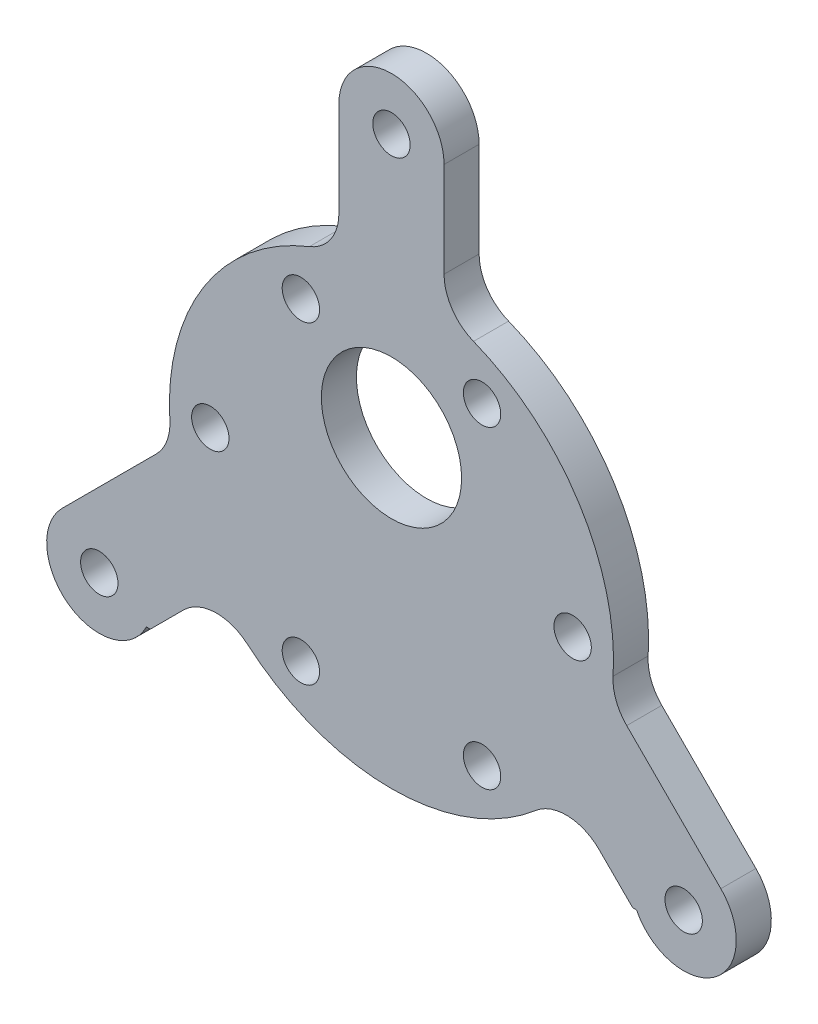
from build123d import *

# Parameters (mm, degrees)
SKETCH_1_R      = 1.6
SKETCH_1_R_2    = 6
EXTRUDE_1_DEPTH = 3
FILLET_1_R      = 4


with BuildPart() as part:
    # 草图1 → 凸台-拉伸1 (new body)
    # profile 1 of 13: a face of its own
    with BuildSketch(Plane.XY):
        with BuildLine():
            ThreePointArc((64, -7), (59.941552797, 4.736694594), (49.5, 11.459414942))
            ThreePointArc((49.5, 11.459414942), (45, 12), (40.5, 11.459414942))
            ThreePointArc((40.5, 11.459414942), (29.2006815, 3.553745068), (26.224418371, -9.911620598))
            ThreePointArc((26.224418371, -9.911620598), (27.583310363, -14.593347225), (30.0887682, -18.775192831))
            ThreePointArc((30.0887682, -18.775192831), (33.483334572, -22.111797293), (37.600675707, -24.5))
            Line((37.600675707, -24.5), (52.399324293, -24.5))
            ThreePointArc((52.399324293, -24.5), (56.516665428, -22.111797293), (59.9112318, -18.775192831))
            ThreePointArc((59.9112318, -18.775192831), (62.416689637, -14.593347225), (63.775581629, -9.911620598))
            ThreePointArc((63.775581629, -9.911620598), (63.943812327, -8.460128257), (64, -7))
        make_face()
        with Locations((37.25, -20.423393759)):
            Circle(SKETCH_1_R, mode=Mode.SUBTRACT)
        with Locations((52.75, -20.423393759)):
            Circle(SKETCH_1_R, mode=Mode.SUBTRACT)
        with Locations((29.5, -7)):
            Circle(SKETCH_1_R, mode=Mode.SUBTRACT)
        with Locations((60.5, -7)):
            Circle(SKETCH_1_R, mode=Mode.SUBTRACT)
        with Locations((45, 0)):
            Circle(SKETCH_1_R_2, mode=Mode.SUBTRACT)
        with Locations((37.25, 6.423393759)):
            Circle(SKETCH_1_R, mode=Mode.SUBTRACT)
        with Locations((52.75, 6.423393759)):
            Circle(SKETCH_1_R, mode=Mode.SUBTRACT)
    # profile 2 of 13: a face of its own
    with BuildSketch(Plane.XY):
        with BuildLine():
            ThreePointArc((30.0887682, -18.775192831), (27.583310363, -14.593347225), (26.224418371, -9.911620598))
            Line((26.224418371, -9.911620598), (16.818019485, -19.318019485))
            ThreePointArc((16.818019485, -19.318019485), (21.722075446, -18.342542104), (24.5, -22.5))
            Line((24.5, -22.5), (24.5, -24.363961031))
            Line((24.5, -24.363961031), (30.0887682, -18.775192831))
        make_face()
    # profile 3 of 13: a face of its own
    with BuildSketch(Plane.XY):
        with BuildLine():
            ThreePointArc((24.5, -22.5), (21.722075446, -18.342542104), (16.818019485, -19.318019485))
            ThreePointArc((16.818019485, -19.318019485), (15.842542104, -20.777924554), (15.5, -22.5))
            ThreePointArc((15.5, -22.5), (15.61878556, -23.527112473), (15.968871126, -24.5))
            Line((15.968871126, -24.5), (24.031128874, -24.5))
            ThreePointArc((24.031128874, -24.5), (24.38121444, -23.527112473), (24.5, -22.5))
        make_face()
        with Locations((20, -22.5)):
            Circle(SKETCH_1_R, mode=Mode.SUBTRACT)
    # profile 4 of 13: a face of its own
    with BuildSketch(Plane.XY):
        with BuildLine():
            Line((24.031128874, -24.5), (15.968871126, -24.5))
            ThreePointArc((15.968871126, -24.5), (19.272310012, -26.940773275), (23.181980515, -25.681980515))
            ThreePointArc((23.181980515, -25.681980515), (23.654655422, -25.125546372), (24.031128874, -24.5))
        make_face()
    # profile 5 of 13: a face of its own
    with BuildSketch(Plane.XY):
        with BuildLine():
            ThreePointArc((66.818019485, -25.681980515), (70.727689988, -26.940773275), (74.031128874, -24.5))
            Line((74.031128874, -24.5), (65.968871126, -24.5))
            ThreePointArc((65.968871126, -24.5), (66.345344578, -25.125546372), (66.818019485, -25.681980515))
        make_face()
    # profile 6 of 13: a face of its own
    with BuildSketch(Plane.XY):
        with BuildLine():
            ThreePointArc((65.5, -22.5), (68.277924554, -18.342542104), (73.181980515, -19.318019485))
            Line((73.181980515, -19.318019485), (63.775581629, -9.911620598))
            ThreePointArc((63.775581629, -9.911620598), (62.416689637, -14.593347225), (59.9112318, -18.775192831))
            Line((59.9112318, -18.775192831), (65.5, -24.363961031))
            Line((65.5, -24.363961031), (65.5, -22.5))
        make_face()
    # profile 7 of 13: a face of its own
    with BuildSketch(Plane.XY):
        with BuildLine():
            Line((49.5, 11.459414942), (49.5, 22.5))
            ThreePointArc((49.5, 22.5), (45, 18), (40.5, 22.5))
            Line((40.5, 22.5), (40.5, 11.459414942))
            ThreePointArc((40.5, 11.459414942), (45, 12), (49.5, 11.459414942))
        make_face()
    # profile 8 of 13: a face of its own
    with BuildSketch(Plane.XY):
        with BuildLine():
            ThreePointArc((49.5, 22.5), (49.38121444, 23.527112473), (49.031128874, 24.5))
            Line((49.031128874, 24.5), (40.968871126, 24.5))
            ThreePointArc((40.968871126, 24.5), (40.61878556, 23.527112473), (40.5, 22.5))
            ThreePointArc((40.5, 22.5), (45, 18), (49.5, 22.5))
        make_face()
        with Locations((45, 22.5)):
            Circle(SKETCH_1_R, mode=Mode.SUBTRACT)
    # profile 9 of 13: a face of its own
    with BuildSketch(Plane.XY):
        with BuildLine():
            Line((40.968871126, 24.5), (49.031128874, 24.5))
            ThreePointArc((49.031128874, 24.5), (45, 27), (40.968871126, 24.5))
        make_face()
    # profile 10 of 13: a face of its own
    with BuildSketch(Plane.XY):
        with BuildLine():
            Line((24.5, -24.363961031), (24.5, -22.5))
            ThreePointArc((24.5, -22.5), (24.38121444, -23.527112473), (24.031128874, -24.5))
            Line((24.031128874, -24.5), (24.363961031, -24.5))
            Line((24.363961031, -24.5), (24.5, -24.363961031))
        make_face()
    # profile 11 of 13: a face of its own
    with BuildSketch(Plane.XY):
        with BuildLine():
            Line((65.636038969, -24.5), (65.968871126, -24.5))
            ThreePointArc((65.968871126, -24.5), (65.61878556, -23.527112473), (65.5, -22.5))
            Line((65.5, -22.5), (65.5, -24.363961031))
            Line((65.5, -24.363961031), (65.636038969, -24.5))
        make_face()
    # profile 12 of 13: a face of its own
    with BuildSketch(Plane.XY):
        with BuildLine():
            Line((65.968871126, -24.5), (74.031128874, -24.5))
            ThreePointArc((74.031128874, -24.5), (74.38121444, -23.527112473), (74.5, -22.5))
            ThreePointArc((74.5, -22.5), (74.157457896, -20.777924554), (73.181980515, -19.318019485))
            ThreePointArc((73.181980515, -19.318019485), (68.277924554, -18.342542104), (65.5, -22.5))
            ThreePointArc((65.5, -22.5), (65.61878556, -23.527112473), (65.968871126, -24.5))
        make_face()
        with Locations((70, -22.5)):
            Circle(SKETCH_1_R, mode=Mode.SUBTRACT)
    # profile 13 of 13: a face of its own
    with BuildSketch(Plane.XY):
        with BuildLine():
            ThreePointArc((37.600675707, -24.5), (45, -26), (52.399324293, -24.5))
            Line((52.399324293, -24.5), (37.600675707, -24.5))
        make_face()
    extrude(amount=EXTRUDE_1_DEPTH)

    # 圆角1
    fillet_1_edges = [part.edges().sort_by_distance(p)[0] for p in [
        (59.9112318, -18.775192831, 1.5),
        (30.0887682, -18.775192831, 1.5),
        (26.224418371, -9.911620598, 1.5),
        (40.5, 11.459414942, 1.5),
        (49.5, 11.459414942, 1.5),
        (63.775581629, -9.911620598, 1.5),
    ]]
    fillet(fillet_1_edges, radius=FILLET_1_R)


solid = part.part
